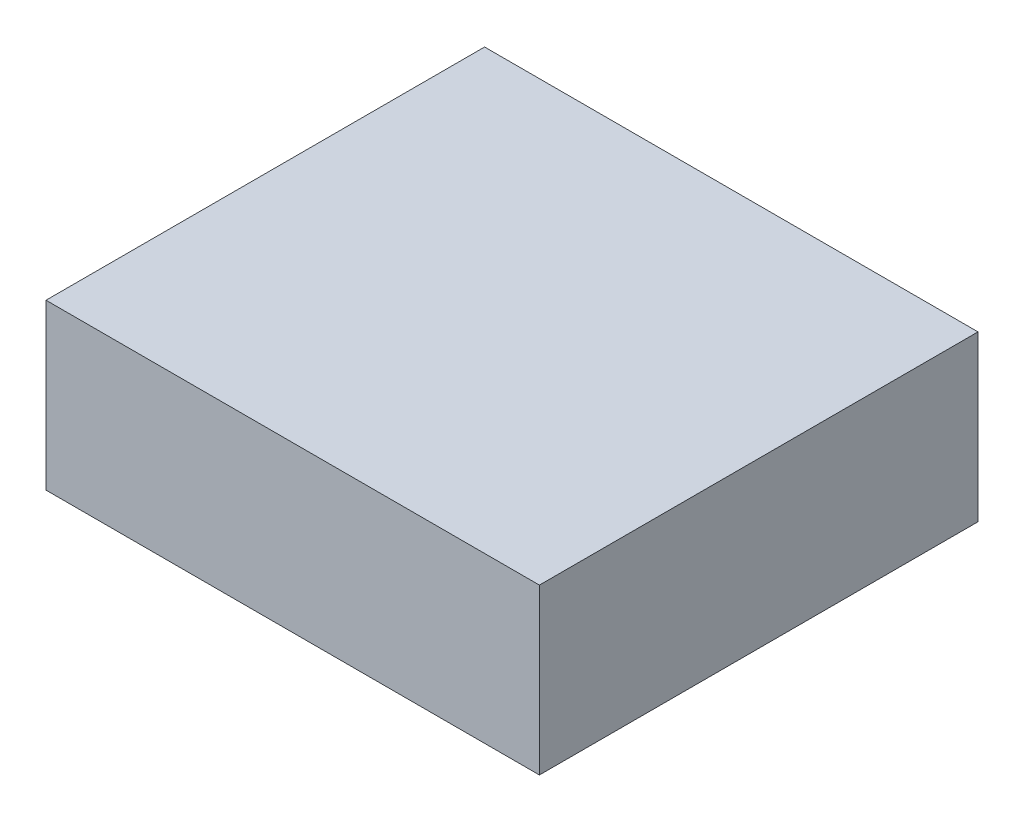
from build123d import *

# Parameters (mm, degrees)
BOSS_EXTRUDE1_START = 1240
SKETCH1_W           = 900
SKETCH1_H           = 300
BOSS_EXTRUDE1_DEPTH = 800


with BuildPart() as part:
    # Sketch1 → Boss-Extrude1 (new body)
    with BuildSketch(Plane.XY.offset(BOSS_EXTRUDE1_START)):
        with Locations((-400, -80)):
            Rectangle(SKETCH1_W, SKETCH1_H)
    extrude(amount=BOSS_EXTRUDE1_DEPTH)


solid = part.part
